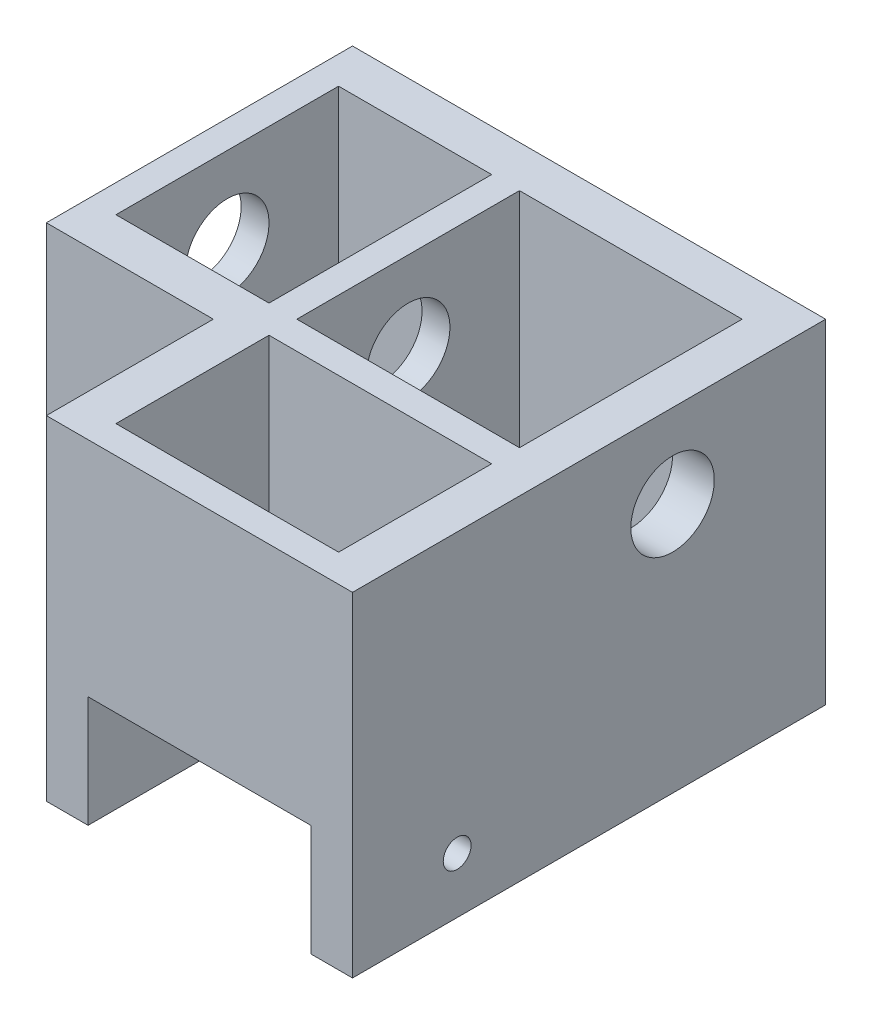
from build123d import *

# Parameters (mm, degrees)
SKETCH1_W               = 139.7
SKETCH1_H               = 139.7
SKETCH1_W_2             = 101.6
SKETCH1_H_2             = 101.6
EXTRUDE_THIN1_DEPTH     = 152.4
CUT_EXTRUDE2_START      = -50.8
SKETCH3_W               = 19.05
SKETCH3_H               = 101.6
CUT_EXTRUDE2_DEPTH      = 50.8
BOSS_EXTRUDE2_DEPTH     = 76.2
SKETCH6_W               = 69.85
SKETCH6_H               = 101.6
CUT_EXTRUDE3_DEPTH      = 223.34069578
SKETCH8_R               = 6.35
CUT_EXTRUDE4_DEPTH      = 254.125369136
SKETCH9_W               = 215.9
SKETCH9_H               = 152.4
CUT_EXTRUDE6_DEPTH      = 304.76371755
CUT_EXTRUDE7_DEPTH      = 302.94233307
CUT_EXTRUDE7_DEPTH_BACK = 302.94233307
SKETCH10_R              = 19.05


with BuildPart() as part:
    # Sketch1 → Extrude-Thin1 (new body)
    with BuildSketch(Plane(origin=(0, 0, 0), x_dir=(1, 0, 0), z_dir=(0, 1, 0))):
        Rectangle(SKETCH1_W, SKETCH1_H)
        Rectangle(SKETCH1_W_2, SKETCH1_H_2, mode=Mode.SUBTRACT)
    extrude(amount=EXTRUDE_THIN1_DEPTH)

    # Sketch3 → Cut-Extrude2 (cut)
    with BuildSketch(Plane.XZ.offset(CUT_EXTRUDE2_START)):
        with Locations((-60.325, 0)):
            Rectangle(SKETCH3_W, SKETCH3_H)
    cut_extrude2 = extrude(amount=CUT_EXTRUDE2_DEPTH, mode=Mode.SUBTRACT)

    # Sketch5 → Boss-Extrude2 (add)
    with BuildSketch(Plane.ZY.offset(69.85)):
        Polygon((-50.8, 50.8), (50.8, 50.8), (50.8, 0), (69.85, 0), (69.85, 152.4), (-69.85, 152.4), (-69.85, 0), (-50.8, 0), align=None)
    boss_extrude2 = extrude(amount=BOSS_EXTRUDE2_DEPTH)

    # Sketch6 → Cut-Extrude3 (cut, through all)
    with BuildSketch(Plane(origin=(0, 152.4, 0), x_dir=(1, 0, 0), z_dir=(0, 1, 0))):
        with Locations((-98.425, 0)):
            Rectangle(SKETCH6_W, SKETCH6_H)
    cut_extrude3 = extrude(amount=-CUT_EXTRUDE3_DEPTH, mode=Mode.SUBTRACT)

    # Sketch8 → Cut-Extrude4 (cut, through all)
    with BuildSketch(Plane.XY.offset(69.85)):
        with Locations((-98.298, 25.4)):
            Circle(SKETCH8_R)
    cut_extrude4 = extrude(amount=-CUT_EXTRUDE4_DEPTH, mode=Mode.SUBTRACT)

    # Mirror3: Cut-Extrude2, Boss-Extrude2, Cut-Extrude3, Cut-Extrude4 across plane
    add(cut_extrude2.mirror(Plane(origin=(0, 0, 0), x_dir=(-0.7071067811865476, 0, 0.7071067811865476), z_dir=(-0.7071067811865477, 0, -0.7071067811865475))), mode=Mode.SUBTRACT)
    add(boss_extrude2.mirror(Plane(origin=(0, 0, 0), x_dir=(-0.7071067811865476, 0, 0.7071067811865476), z_dir=(-0.7071067811865477, 0, -0.7071067811865475))))
    add(cut_extrude3.mirror(Plane(origin=(0, 0, 0), x_dir=(-0.7071067811865476, 0, 0.7071067811865476), z_dir=(-0.7071067811865477, 0, -0.7071067811865475))), mode=Mode.SUBTRACT)
    add(cut_extrude4.mirror(Plane(origin=(0, 0, 0), x_dir=(-0.7071067811865476, 0, 0.7071067811865476), z_dir=(-0.7071067811865477, 0, -0.7071067811865475))), mode=Mode.SUBTRACT)


with BuildPart() as body_2:
    # Mirror5: mirrored copy
    add(part.part.mirror(Plane(origin=(72.39, 0, 0), x_dir=(0, 0, 1), z_dir=(1, 0, 0))))

    # Sketch9 → Cut-Extrude6 (cut, through all)
    with BuildSketch(Plane(origin=(72.39, 0, 0), x_dir=(0, 0, -1), z_dir=(1, 0, 0))):
        with Locations((-38.1, 76.2)):
            Rectangle(SKETCH9_W, SKETCH9_H)
    extrude(amount=CUT_EXTRUDE6_DEPTH, mode=Mode.SUBTRACT)


with BuildPart() as part_1:
    add(part.part)

    # Sketch10 → Cut-Extrude7 (cut, two sides: drawn at the far end of the back side and taken through both)
    with BuildSketch(Plane.ZY.offset(146.05).offset(-CUT_EXTRUDE7_DEPTH_BACK)):
        with Locations((0, 114.3)):
            Circle(SKETCH10_R)
    extrude(amount=CUT_EXTRUDE7_DEPTH + CUT_EXTRUDE7_DEPTH_BACK, mode=Mode.SUBTRACT)


solid = part_1.part
